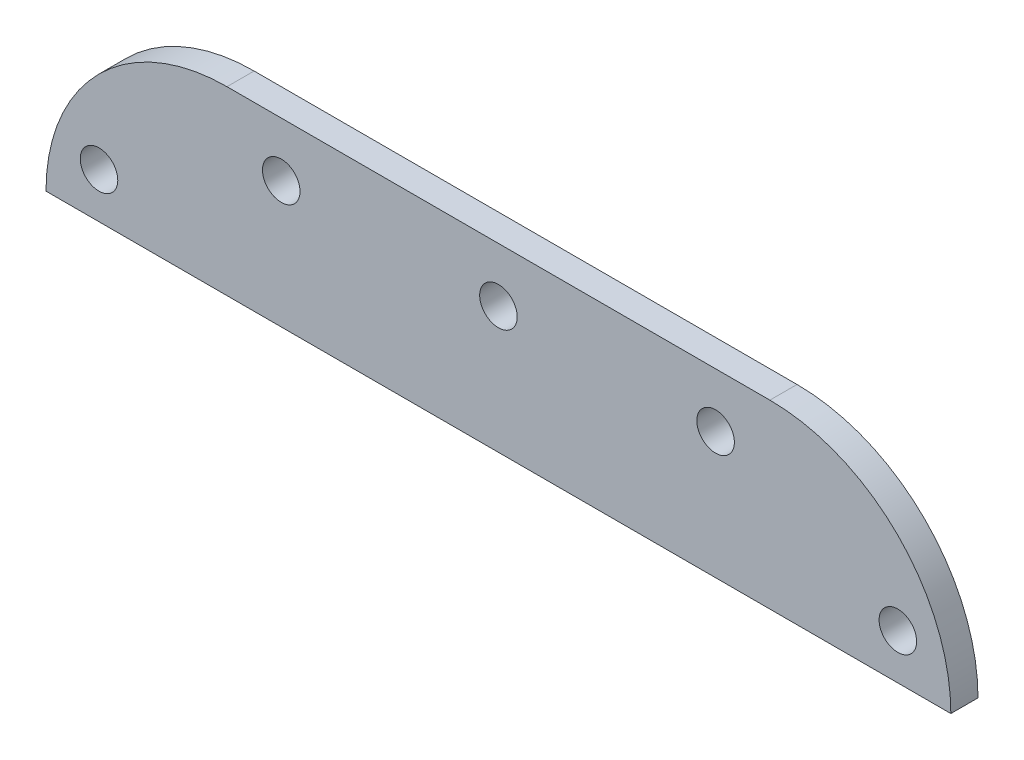
from build123d import *

# Parameters (mm, degrees)
SKETCH1_R           = 4.15
BOSS_EXTRUDE1_DEPTH = 6


with BuildPart() as part:
    # Sketch1 → Boss-Extrude1 (new body)
    with BuildSketch(Plane.XY):
        with BuildLine():
            Line((-60, 20), (60, 20))
            ThreePointArc((60, 20), (88.284271247, 8.284271247), (100, -20))
            Line((100, -20), (-100, -20))
            ThreePointArc((-100, -20), (-88.284271247, 8.284271247), (-60, 20))
        make_face()
        with Locations((0, 8)):
            Circle(SKETCH1_R, mode=Mode.SUBTRACT)
        with Locations((48, 8)):
            Circle(SKETCH1_R, mode=Mode.SUBTRACT)
        with Locations((-48, 8)):
            Circle(SKETCH1_R, mode=Mode.SUBTRACT)
        with Locations((-88.284271247, -10)):
            Circle(SKETCH1_R, mode=Mode.SUBTRACT)
        with Locations((88.284271247, -10)):
            Circle(SKETCH1_R, mode=Mode.SUBTRACT)
    extrude(amount=BOSS_EXTRUDE1_DEPTH)


solid = part.part
